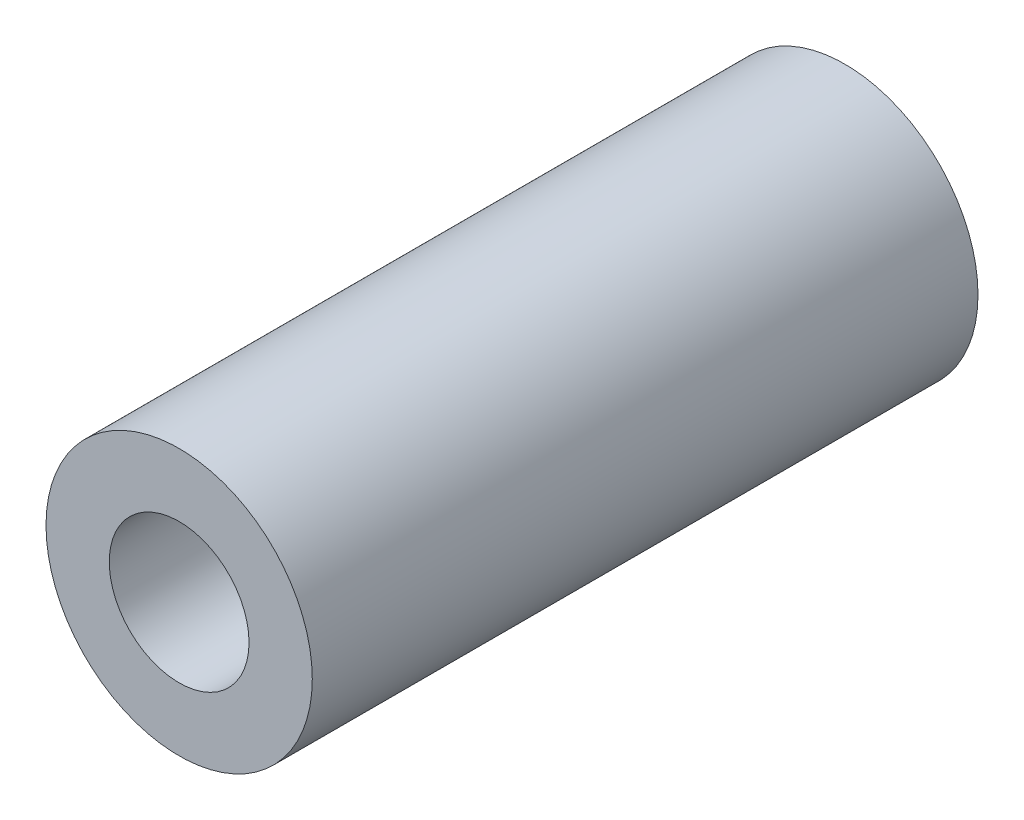
from build123d import *

# Parameters (mm, degrees)
SKETCH1_R           = 10
SKETCH1_R_2         = 5.25
BOSS_EXTRUDE1_DEPTH = 50


with BuildPart() as part:
    # Sketch1 → Boss-Extrude1 (new body)
    with BuildSketch(Plane.XY):
        Circle(SKETCH1_R)
        Circle(SKETCH1_R_2, mode=Mode.SUBTRACT)
    extrude(amount=BOSS_EXTRUDE1_DEPTH)


solid = part.part
